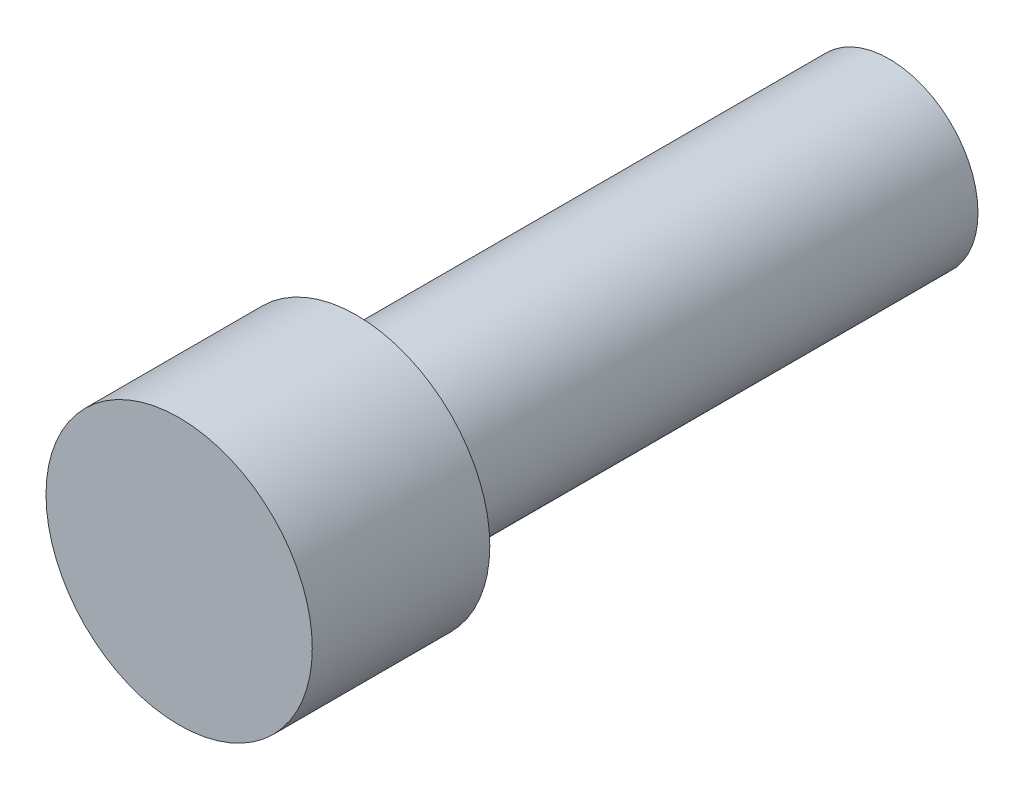
from build123d import *

# Parameters (mm, degrees)
SKETCH1_R           = 5
BOSS_EXTRUDE1_DEPTH = 30
SKETCH2_R           = 7.5
BOSS_EXTRUDE2_DEPTH = 10


with BuildPart() as part:
    # Sketch1 → Boss-Extrude1 (new body)
    with BuildSketch(Plane.XY):
        Circle(SKETCH1_R)
    extrude(amount=BOSS_EXTRUDE1_DEPTH)

    # Sketch2 → Boss-Extrude2 (add)
    with BuildSketch(Plane.XY.offset(30)):
        Circle(SKETCH2_R)
    extrude(amount=BOSS_EXTRUDE2_DEPTH)


solid = part.part
